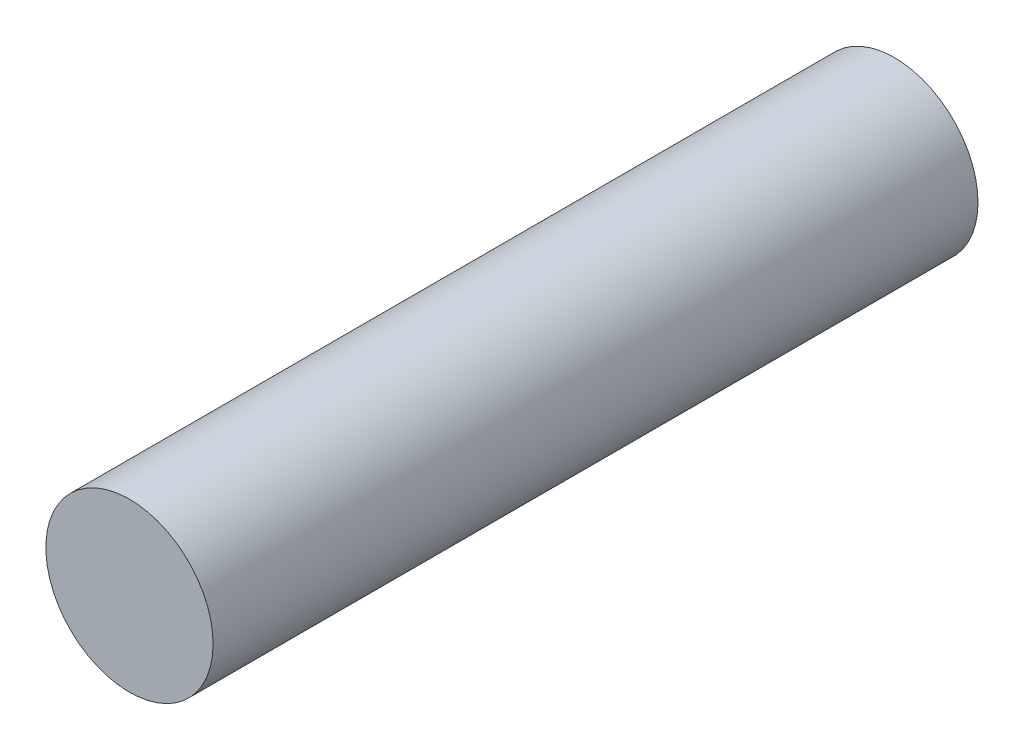
from build123d import *

# Parameters (mm, degrees)
SKETCH_1_R      = 3.279587778
EXTRUDE_1_DEPTH = 30


with BuildPart() as part:
    # 草图1 → 凸台-拉伸1 (new body)
    with BuildSketch(Plane.XY):
        Circle(SKETCH_1_R)
    extrude(amount=EXTRUDE_1_DEPTH)


solid = part.part
